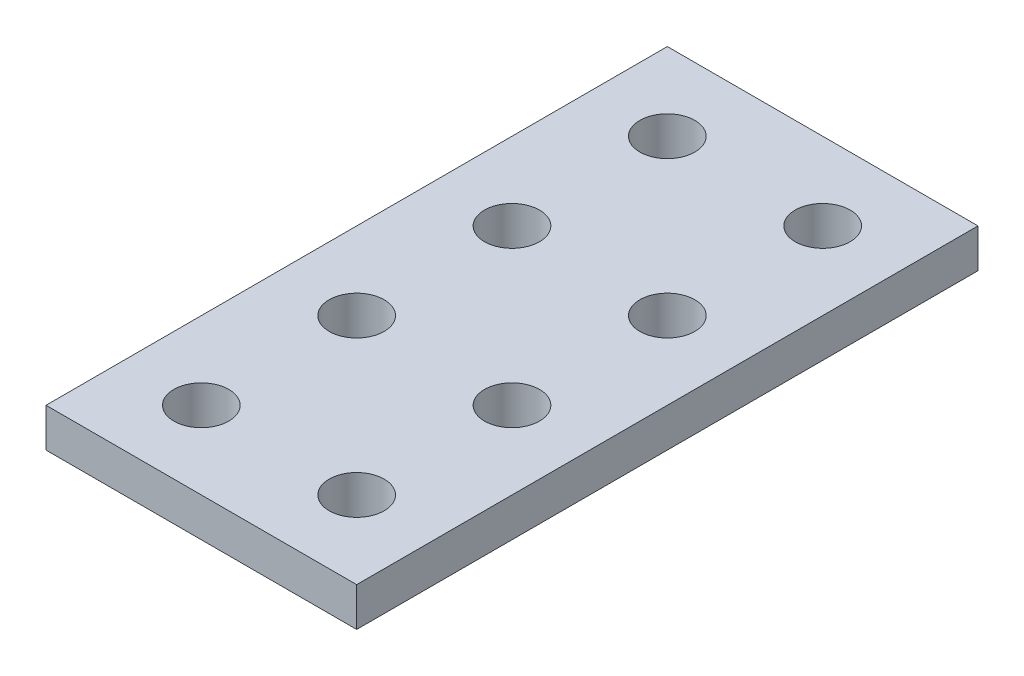
from build123d import *

# Parameters (mm, degrees)
SKETCH1_W           = 25.4
SKETCH1_H           = 50.8
SKETCH1_R           = 2.2479
BOSS_EXTRUDE1_DEPTH = 3.175


with BuildPart() as part:
    # Sketch1 → Boss-Extrude1 (new body)
    with BuildSketch(Plane(origin=(0, 0, 0), x_dir=(1, 0, 0), z_dir=(0, 1, 0))):
        with Locations((12.7, -25.4)):
            Rectangle(SKETCH1_W, SKETCH1_H)
        with Locations(Location((6.35, -6.35, 0), (0, 0, 270))):
            Circle(SKETCH1_R, mode=Mode.SUBTRACT)
        with Locations(Location((19.05, -6.35, 0), (0, 0, 270))):
            Circle(SKETCH1_R, mode=Mode.SUBTRACT)
        with Locations(Location((19.05, -19.05, 0), (0, 0, 270))):
            Circle(SKETCH1_R, mode=Mode.SUBTRACT)
        with Locations(Location((19.05, -31.75, 0), (0, 0, 270))):
            Circle(SKETCH1_R, mode=Mode.SUBTRACT)
        with Locations(Location((19.05, -44.45, 0), (0, 0, 270))):
            Circle(SKETCH1_R, mode=Mode.SUBTRACT)
        with Locations(Location((6.35, -19.05, 0), (0, 0, 270))):
            Circle(SKETCH1_R, mode=Mode.SUBTRACT)
        with Locations(Location((6.35, -31.75, 0), (0, 0, 270))):
            Circle(SKETCH1_R, mode=Mode.SUBTRACT)
        with Locations(Location((6.35, -44.45, 0), (0, 0, 270))):
            Circle(SKETCH1_R, mode=Mode.SUBTRACT)
    extrude(amount=BOSS_EXTRUDE1_DEPTH)


solid = part.part
